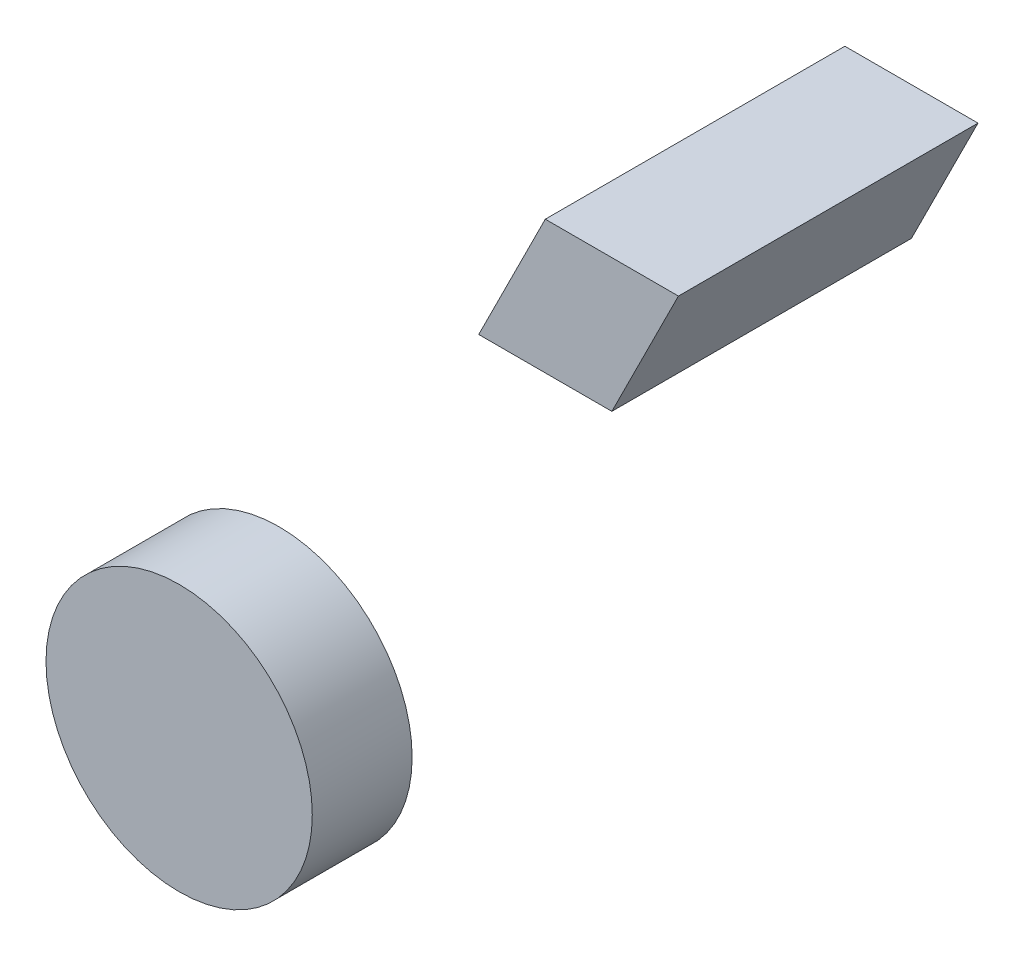
from build123d import *

# Parameters (mm, degrees)
SKETCH_1_R          = 8
EXTRUDE_1_DEPTH     = 24
SKETCH_2_R          = 42
EXTRUDE_2_DEPTH     = 18
SKETCH_3_OUTSIDE_W  = 110.238
SKETCH_3_OUTSIDE_H  = 110.238
CUT_EXTRUDE_1_DEPTH = 63.064482597


with BuildPart() as part:
    # 草图1 → 凸台-拉伸1 (new body)
    with BuildSketch(Plane.XY):
        Circle(SKETCH_1_R)
    extrude(amount=EXTRUDE_1_DEPTH)

    # 草图2 → 凸台-拉伸2 (add)
    with BuildSketch(Plane.XY):
        Circle(SKETCH_2_R)
    extrude(amount=EXTRUDE_2_DEPTH)

    # 草图3 outside → 切除-拉伸1 (cut, through all)
    with BuildSketch(Plane.XY.offset(18)):
        Rectangle(SKETCH_3_OUTSIDE_W, SKETCH_3_OUTSIDE_H)
        Polygon((16, 32), (24, 32), (20, 24), (12, 24), align=None, mode=Mode.SUBTRACT)
    extrude(amount=-CUT_EXTRUDE_1_DEPTH, mode=Mode.SUBTRACT)


with BuildPart() as cut_extrude_1_piece_1:
    # of the separate pieces the step leaves, piece 1, a body of its own (cut_extrude_1_pieces)
    add(part.part.solids().sort_by_distance((8, 0, 18))[0])


with BuildPart() as cut_extrude_1_piece_2:
    # of the separate pieces the step leaves, piece 2, a body of its own (cut_extrude_1_pieces)
    add(part.part.solids().sort_by_distance((16, 32, 0))[0])


solid = Compound([cut_extrude_1_piece_1.part, cut_extrude_1_piece_2.part])
